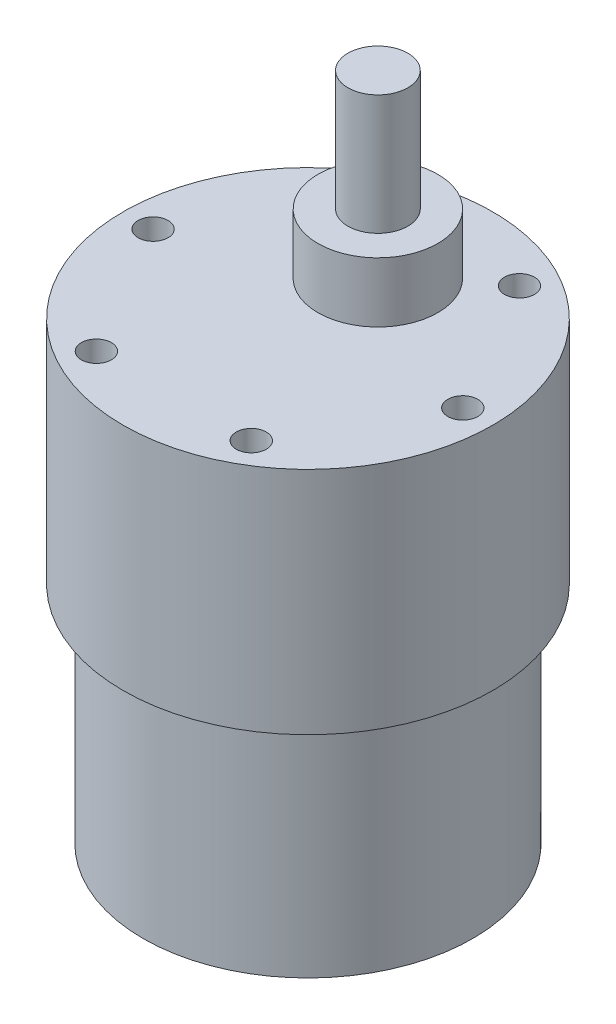
from build123d import *

# Parameters (mm, degrees)
SKETCH_1_R          = 18.5
EXTRUDE_1_DEPTH     = 23
SKETCH_2_R          = 16.5
EXTRUDE_2_DEPTH     = 22.5
SKETCH_3_R          = 1.5
CUT_EXTRUDE_1_DEPTH = 10
SKETCH_4_R          = 6
EXTRUDE_3_DEPTH     = 6
SKETCH_5_R          = 3
EXTRUDE_4_DEPTH     = 12


with BuildPart() as part:
    # 草图1 → 凸台-拉伸1 (new body)
    with BuildSketch(Plane(origin=(0, 0, 0), x_dir=(1, 0, 0), z_dir=(0, 1, 0))):
        with Locations(Location((0, 0, 0), (0, 0, 270))):
            Circle(SKETCH_1_R)
    extrude(amount=-EXTRUDE_1_DEPTH)

    # 草图2 → 凸台-拉伸2 (add)
    with BuildSketch(Plane.XZ.offset(23)):
        with Locations(Location((0, 0, 0), (0, 0, 90))):
            Circle(SKETCH_2_R)
    extrude(amount=EXTRUDE_2_DEPTH)

    # 草图3 → 切除-拉伸1 (cut)
    with BuildSketch(Plane(origin=(0, 0, 0), x_dir=(1, 0, 0), z_dir=(0, 1, 0))):
        with Locations(Location((-15.5, 0, 0), (0, 0, 270))):
            Circle(SKETCH_3_R)
        with Locations(Location((-7.75, 13.423393759, 0), (0, 0, 270))):
            Circle(SKETCH_3_R)
        with Locations(Location((7.75, 13.423393759, 0), (0, 0, 270))):
            Circle(SKETCH_3_R)
        with Locations(Location((15.5, 0, 0), (0, 0, 270))):
            Circle(SKETCH_3_R)
        with Locations(Location((7.75, -13.423393759, 0), (0, 0, 270))):
            Circle(SKETCH_3_R)
        with Locations(Location((-7.75, -13.423393759, 0), (0, 0, 270))):
            Circle(SKETCH_3_R)
    extrude(amount=-CUT_EXTRUDE_1_DEPTH, mode=Mode.SUBTRACT)

    # 草图4 → 凸台-拉伸3 (add)
    with BuildSketch(Plane(origin=(0, 0, 0), x_dir=(1, 0, 0), z_dir=(0, 1, 0))):
        with Locations(Location((0, 7, 0), (0, 0, 270))):
            Circle(SKETCH_4_R)
    extrude(amount=EXTRUDE_3_DEPTH)

    # 草图5 → 凸台-拉伸4 (add)
    with BuildSketch(Plane(origin=(0, 6, 0), x_dir=(1, 0, 0), z_dir=(0, 1, 0))):
        with Locations(Location((0, 7, 0), (0, 0, 270))):
            Circle(SKETCH_5_R)
    extrude(amount=EXTRUDE_4_DEPTH)


solid = part.part
